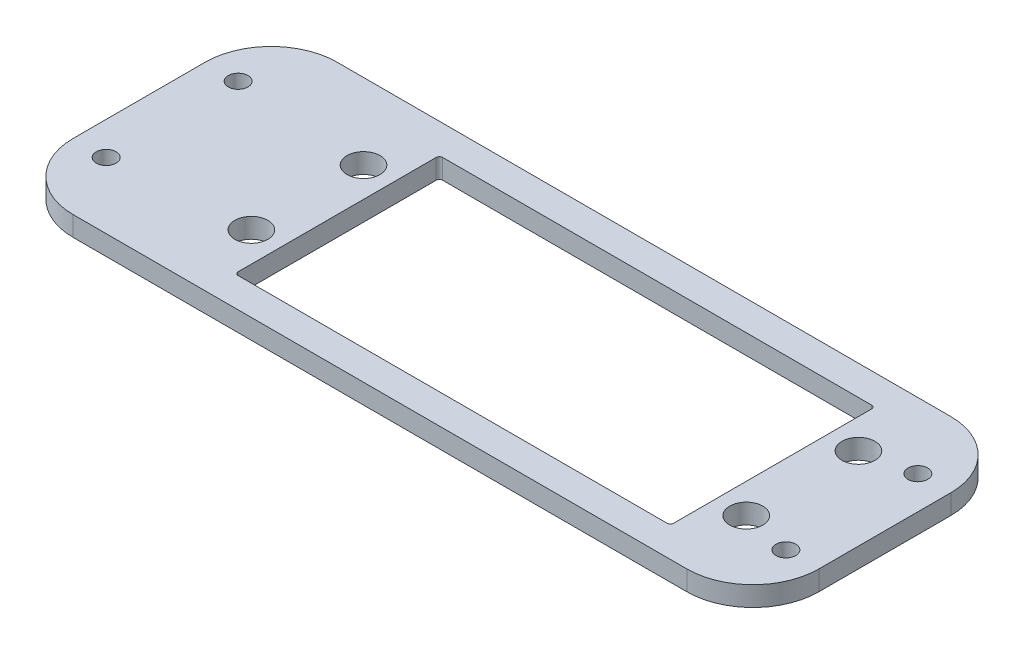
from build123d import *

# Parameters (mm, degrees)
SKETCH_1_W      = 100
SKETCH_1_H      = 40
SKETCH_1_R      = 2.5
SKETCH_1_R_2    = 1.5
SKETCH_1_W_2    = 66
SKETCH_1_H_2    = 31
SKETCH_1_W_3    = 13
EXTRUDE_1_DEPTH = 3
FILLET_1_R      = 0.5
FILLET_2_R      = 10


with BuildPart() as part:
    # 草图1 → 凸台-拉伸1 (new body)
    # profile 1 of 2: a face of its own
    with BuildSketch(Plane(origin=(0, 0, 0), x_dir=(1, 0, 0), z_dir=(0, 1, 0))):
        Rectangle(SKETCH_1_W, SKETCH_1_H)
        with Locations(Location((-37.5, 8.5, 0), (0, 0, 270))):
            Circle(SKETCH_1_R, mode=Mode.SUBTRACT)
        with Locations(Location((-37.5, -8.5, 0), (0, 0, 270))):
            Circle(SKETCH_1_R, mode=Mode.SUBTRACT)
        with Locations(Location((37.5, 8.5, 0), (0, 0, 270))):
            Circle(SKETCH_1_R, mode=Mode.SUBTRACT)
        with Locations(Location((37.5, -8.5, 0), (0, 0, 270))):
            Circle(SKETCH_1_R, mode=Mode.SUBTRACT)
        with Locations(Location((45, 10, 0), (0, 0, 270))):
            Circle(SKETCH_1_R_2, mode=Mode.SUBTRACT)
        with Locations(Location((45, -10, 0), (0, 0, 270))):
            Circle(SKETCH_1_R_2, mode=Mode.SUBTRACT)
        Rectangle(SKETCH_1_W_2, SKETCH_1_H_2, mode=Mode.SUBTRACT)
    # profile 2 of 2: a face of its own
    with BuildSketch(Plane(origin=(0, 0, 0), x_dir=(1, 0, 0), z_dir=(0, 1, 0))):
        with Locations((-56.5, 0)):
            Rectangle(SKETCH_1_W_3, SKETCH_1_H)
        with Locations(Location((-58, 10, 0), (0, 0, 270))):
            Circle(SKETCH_1_R_2, mode=Mode.SUBTRACT)
        with Locations(Location((-58, -10, 0), (0, 0, 270))):
            Circle(SKETCH_1_R_2, mode=Mode.SUBTRACT)
    extrude(amount=EXTRUDE_1_DEPTH)

    # 圆角1
    fillet_1_edges = [part.edges().sort_by_distance(p)[0] for p in [
        (33, 1.5, -15.5),
        (-33, 1.5, -15.5),
        (-33, 1.5, 15.5),
        (33, 1.5, 15.5),
    ]]
    fillet(fillet_1_edges, radius=FILLET_1_R)

    # 圆角2
    fillet_2_edges = [part.edges().sort_by_distance(p)[0] for p in [
        (-63, 1.5, 20),
        (-63, 1.5, -20),
        (50, 1.5, -20),
        (50, 1.5, 20),
    ]]
    fillet(fillet_2_edges, radius=FILLET_2_R)


solid = part.part
